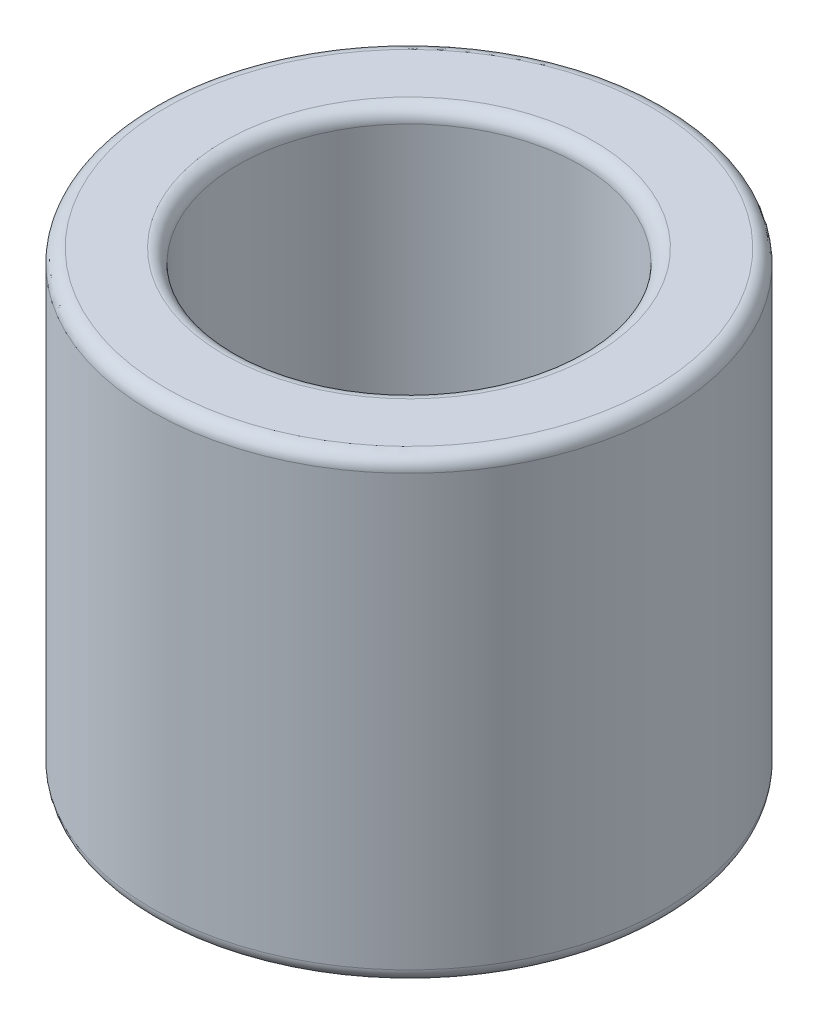
from build123d import *

# Parameters (mm, degrees)
SKETCH1_R           = 4.7625
SKETCH1_R_2         = 3.175
BOSS_EXTRUDE1_DEPTH = 8.4836
FILLET1_R           = 0.254


with BuildPart() as part:
    # Sketch1 → Boss-Extrude1 (new body)
    with BuildSketch(Plane(origin=(0, 0, 0), x_dir=(1, 0, 0), z_dir=(0, 1, 0))):
        with Locations(Location((0, 0, 0), (0, 0, 90))):
            Circle(SKETCH1_R)
        with Locations(Location((0, 0, 0), (0, 0, 90))):
            Circle(SKETCH1_R_2, mode=Mode.SUBTRACT)
    extrude(amount=BOSS_EXTRUDE1_DEPTH)

    # Fillet1
    fillet1_edges = [part.edges().sort_by_distance(p)[0] for p in [
        (0, 0, 4.7625),
        (0, 8.4836, 4.7625),
        (0, 0, 3.175),
        (0, 8.4836, 3.175),
    ]]
    fillet(fillet1_edges, radius=FILLET1_R)


solid = part.part
